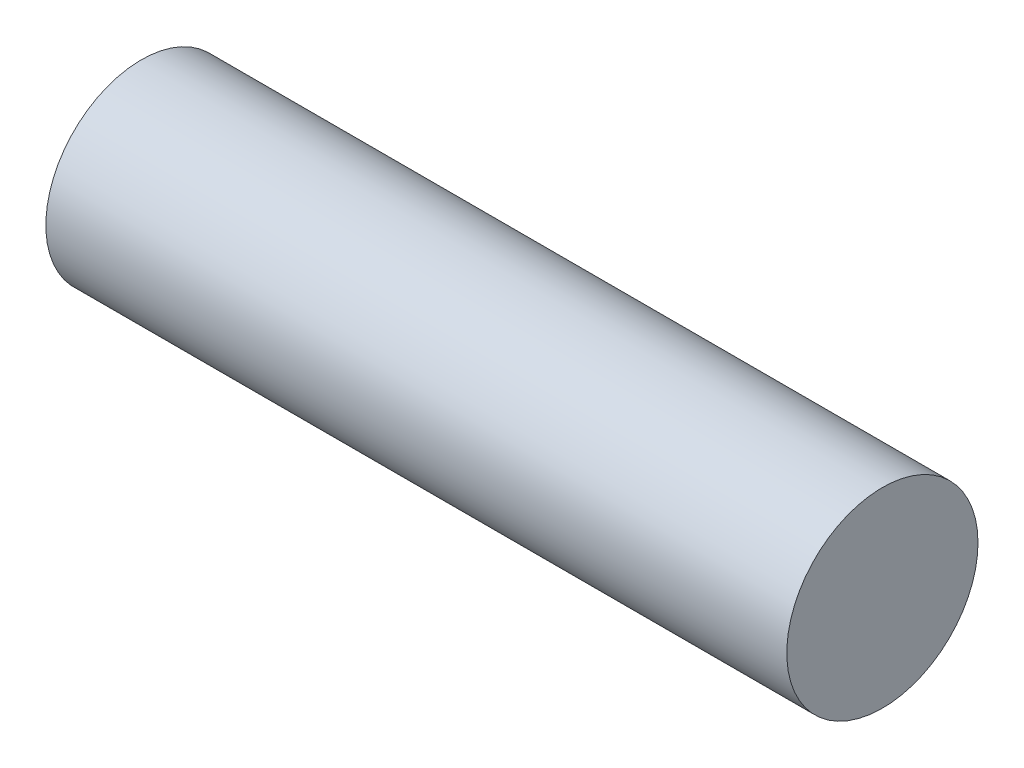
from build123d import *

# Parameters (mm, degrees)
SKETCH2_R           = 2
BOSS_EXTRUDE1_DEPTH = 15.5


with BuildPart() as part:
    # Sketch2 → Boss-Extrude1 (new body)
    with BuildSketch(Plane(origin=(0, 0, 0), x_dir=(0, 0, -1), z_dir=(1, 0, 0))):
        Circle(SKETCH2_R)
    extrude(amount=BOSS_EXTRUDE1_DEPTH)


solid = part.part
